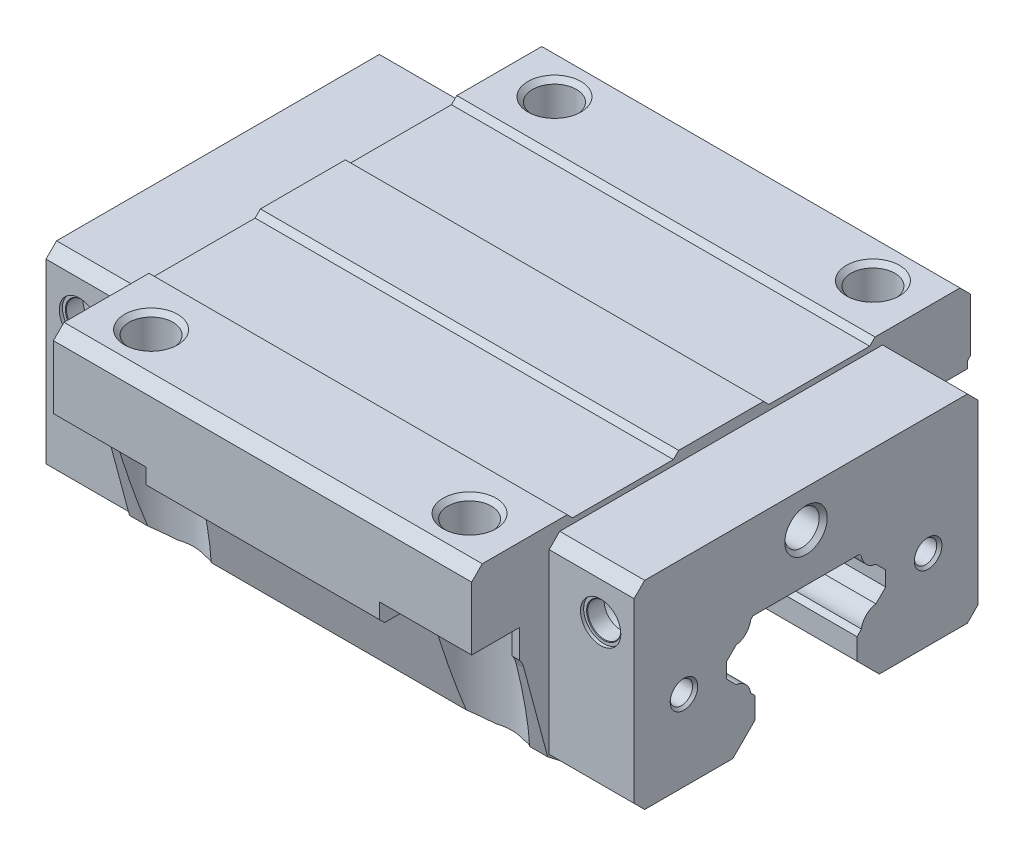
from build123d import *

# Parameters (mm, degrees)
EXTRUDE_1_DEPTH          = 19.7
EXTRUDE_1_DEPTH_BACK     = 19.7
EXTRUDE_2_DEPTH          = 27.7
EXTRUDE_2_DEPTH_BACK     = 27.7
CUT_EXTRUDE_1_DEPTH      = 19.7
CUT_EXTRUDE_1_DEPTH_BACK = 19.7
CUT_EXTRUDE_2_DEPTH      = 19.7
CUT_EXTRUDE_START        = -19.7
CUT_EXTRUDE_3_DEPTH      = 19.7
CUT_EXTRUDE_4_DEPTH      = 19.7
CUT_EXTRUDE_5_DEPTH      = 19.7


with BuildPart() as part:
    # Эскиз1 → Бобышка-Вытянуть1 (new, two sides: drawn at the far end of the back side and taken through both)
    with BuildSketch(Plane(origin=(0, 0, 0), x_dir=(0, 0, -1), z_dir=(1, 0, 0)).offset(-EXTRUDE_1_DEPTH_BACK)):
        with BuildLine():
            Line((-23.5, 18.702979439), (-23.5, 11.298510281))
            Line((-23.5, 11.298510281), (-23.001489719, 10.8))
            Line((-23.001489719, 10.8), (-20.534653976, 10.8))
            ThreePointArc((-20.534653976, 10.8), (-19.317131118, 10.386706681), (-18.602802323, 9.31763809))
            Line((-18.602802323, 9.31763809), (-16.33614388, 0.858353615))
            Line((-16.33614388, 0.858353615), (-15.21751567, 0))
            Line((-15.21751567, 0), (15.21751567, 0))
            Line((15.21751567, 0), (16.33614388, 0.858353615))
            Line((16.33614388, 0.858353615), (18.602802323, 9.31763809))
            ThreePointArc((18.602802323, 9.31763809), (19.317131118, 10.386706681), (20.534653976, 10.8))
            Line((20.534653976, 10.8), (22.701489719, 10.8))
            Line((22.701489719, 10.8), (23.2, 11.298510281))
            Line((23.2, 11.298510281), (23.2, 13.4))
            Line((23.2, 13.4), (23.5, 13.7))
            Line((23.5, 13.7), (23.5, 18.702979439))
            Line((23.5, 18.702979439), (22.502979439, 19.7))
            Line((22.502979439, 19.7), (14.5, 19.7))
            Line((14.5, 19.7), (14, 19.2))
            Line((14, 19.2), (4.5, 19.2))
            Line((4.5, 19.2), (4, 19.7))
            Line((4, 19.7), (-4, 19.7))
            Line((-4, 19.7), (-4.5, 19.2))
            Line((-4.5, 19.2), (-14, 19.2))
            Line((-14, 19.2), (-14.5, 19.7))
            Line((-14.5, 19.7), (-22.502979439, 19.7))
            Line((-22.502979439, 19.7), (-23.5, 18.702979439))
        make_face()
    extrude(amount=EXTRUDE_1_DEPTH + EXTRUDE_1_DEPTH_BACK)

    # Эскиз2 → Бобышка-Вытянуть2 (add, two sides: drawn at the far end of the back side and taken through both)
    with BuildSketch(Plane(origin=(0, 0, 0), x_dir=(0, 0, -1), z_dir=(1, 0, 0)).offset(-EXTRUDE_2_DEPTH_BACK)):
        Polygon((-16.2, 0.997020561), (-15.202979439, 0), (15.202979439, 0), (16.2, 0.997020561), (16.2, 17.702979439), (15.202979439, 18.7), (-15.202979439, 18.7), (-16.2, 17.702979439), align=None)
    extrude(amount=EXTRUDE_2_DEPTH + EXTRUDE_2_DEPTH_BACK)

    # Эскиз3 → Вырез-Вытянуть1 (cut, two sides: drawn at the far end of the back side and taken through both)
    with BuildSketch(Plane(origin=(0, 0, 0), x_dir=(0, 0, -1), z_dir=(1, 0, 0)).offset(-CUT_EXTRUDE_1_DEPTH_BACK)):
        with BuildLine():
            Line((-11.2, -4.3), (11.2, -4.3))
            Line((11.2, -4.3), (4.8, 2.1))
            Line((4.8, 2.1), (4.8, 4.1))
            Line((4.8, 4.1), (5.21443454, 4.51443454))
            ThreePointArc((5.21443454, 4.51443454), (5.66862915, 5.43137085), (6.58556546, 5.88556546))
            Line((6.58556546, 5.88556546), (7.5, 6.8))
            Line((7.5, 6.8), (7.5, 8.2))
            Line((7.5, 8.2), (6.58556546, 9.11443454))
            ThreePointArc((6.58556546, 9.11443454), (5.66862915, 9.56862915), (5.21443454, 10.48556546))
            Line((5.21443454, 10.48556546), (5, 10.7))
            Line((5, 10.7), (-5, 10.7))
            Line((-5, 10.7), (-5.21443454, 10.48556546))
            ThreePointArc((-5.21443454, 10.48556546), (-5.66862915, 9.56862915), (-6.58556546, 9.11443454))
            Line((-6.58556546, 9.11443454), (-7.5, 8.2))
            Line((-7.5, 8.2), (-7.5, 6.8))
            Line((-7.5, 6.8), (-6.58556546, 5.88556546))
            ThreePointArc((-6.58556546, 5.88556546), (-5.66862915, 5.43137085), (-5.21443454, 4.51443454))
            Line((-5.21443454, 4.51443454), (-4.8, 4.1))
            Line((-4.8, 4.1), (-4.8, 2.1))
            Line((-4.8, 2.1), (-11.2, -4.3))
        make_face()
    extrude(amount=CUT_EXTRUDE_1_DEPTH + CUT_EXTRUDE_1_DEPTH_BACK, mode=Mode.SUBTRACT)

    # Эскиз4 → Вырез-Вытянуть2 (cut)
    with BuildSketch(Plane(origin=(19.7, 0, 0), x_dir=(0, 0, -1), z_dir=(1, 0, 0))):
        with BuildLine():
            Line((-11.2, -4.3), (11.2, -4.3))
            Line((11.2, -4.3), (4.8, 2.1))
            Line((4.8, 2.1), (4.8, 4.1))
            Line((4.8, 4.1), (5.21443454, 4.51443454))
            ThreePointArc((5.21443454, 4.51443454), (5.66862915, 5.43137085), (6.58556546, 5.88556546))
            Line((6.58556546, 5.88556546), (7.5, 6.8))
            Line((7.5, 6.8), (7.5, 8.2))
            Line((7.5, 8.2), (6.58556546, 9.11443454))
            ThreePointArc((6.58556546, 9.11443454), (5.66862915, 9.56862915), (5.21443454, 10.48556546))
            Line((5.21443454, 10.48556546), (5, 10.7))
            Line((5, 10.7), (-5, 10.7))
            Line((-5, 10.7), (-5.21443454, 10.48556546))
            ThreePointArc((-5.21443454, 10.48556546), (-5.66862915, 9.56862915), (-6.58556546, 9.11443454))
            Line((-6.58556546, 9.11443454), (-7.5, 8.2))
            Line((-7.5, 8.2), (-7.5, 6.8))
            Line((-7.5, 6.8), (-6.58556546, 5.88556546))
            ThreePointArc((-6.58556546, 5.88556546), (-5.66862915, 5.43137085), (-5.21443454, 4.51443454))
            Line((-5.21443454, 4.51443454), (-4.8, 4.1))
            Line((-4.8, 4.1), (-4.8, 2.1))
            Line((-4.8, 2.1), (-11.2, -4.3))
        make_face()
    extrude(amount=CUT_EXTRUDE_2_DEPTH, mode=Mode.SUBTRACT)

    # Эскиз5 → Вырез-Вытянуть3 (cut)
    with BuildSketch(Plane(origin=(-19.7, 0, 0), x_dir=(0, 0, -1), z_dir=(1, 0, 0)).offset(CUT_EXTRUDE_START)):
        with BuildLine():
            Line((-11.2, -4.3), (11.2, -4.3))
            Line((11.2, -4.3), (4.8, 2.1))
            Line((4.8, 2.1), (4.8, 4.1))
            Line((4.8, 4.1), (5.21443454, 4.51443454))
            ThreePointArc((5.21443454, 4.51443454), (5.66862915, 5.43137085), (6.58556546, 5.88556546))
            Line((6.58556546, 5.88556546), (7.5, 6.8))
            Line((7.5, 6.8), (7.5, 8.2))
            Line((7.5, 8.2), (6.58556546, 9.11443454))
            ThreePointArc((6.58556546, 9.11443454), (5.66862915, 9.56862915), (5.21443454, 10.48556546))
            Line((5.21443454, 10.48556546), (5, 10.7))
            Line((5, 10.7), (-5, 10.7))
            Line((-5, 10.7), (-5.21443454, 10.48556546))
            ThreePointArc((-5.21443454, 10.48556546), (-5.66862915, 9.56862915), (-6.58556546, 9.11443454))
            Line((-6.58556546, 9.11443454), (-7.5, 8.2))
            Line((-7.5, 8.2), (-7.5, 6.8))
            Line((-7.5, 6.8), (-6.58556546, 5.88556546))
            ThreePointArc((-6.58556546, 5.88556546), (-5.66862915, 5.43137085), (-5.21443454, 4.51443454))
            Line((-5.21443454, 4.51443454), (-4.8, 4.1))
            Line((-4.8, 4.1), (-4.8, 2.1))
            Line((-4.8, 2.1), (-11.2, -4.3))
        make_face()
    extrude(amount=CUT_EXTRUDE_3_DEPTH, mode=Mode.SUBTRACT)

    # Эскиз6 → Вырез-Повернуть1 (revolve, cut)
    with BuildSketch(Plane.XY.offset(-19)):
        Polygon((15, 19.7), (17.5, 19.7), (17.067, 19.267), (17.067, 13.183), (17.5, 12.75), (17.5, 0), (15, 0), align=None)
    revolve(axis=Axis((15, 0, -19), (0, 1, 0)), mode=Mode.SUBTRACT)

    # Эскиз7 → Вырез-Повернуть2 (revolve, cut)
    with BuildSketch(Plane.XY.offset(-19)):
        Polygon((-15, 19.7), (-12.5, 19.7), (-12.933, 19.267), (-12.933, 13.183), (-12.5, 12.75), (-12.5, 0), (-15, 0), align=None)
    revolve(axis=Axis((-15, 0, -19), (0, 1, 0)), mode=Mode.SUBTRACT)

    # Эскиз8 → Вырез-Повернуть3 (revolve, cut)
    with BuildSketch(Plane.XY.offset(19)):
        Polygon((15, 19.7), (17.5, 19.7), (17.067, 19.267), (17.067, 13.183), (17.5, 12.75), (17.5, 0), (15, 0), align=None)
    revolve(axis=Axis((15, 0, 19), (0, 1, 0)), mode=Mode.SUBTRACT)

    # Эскиз9 → Вырез-Повернуть4 (revolve, cut)
    with BuildSketch(Plane.XY.offset(19)):
        Polygon((-15, 19.7), (-12.5, 19.7), (-12.933, 19.267), (-12.933, 13.183), (-12.5, 12.75), (-12.5, 0), (-15, 0), align=None)
    revolve(axis=Axis((-15, 0, 19), (0, 1, 0)), mode=Mode.SUBTRACT)

    # Эскиз10 → Вырез-Повернуть5 (revolve, cut)
    with BuildSketch(Plane.XY):
        Polygon((-27.7, 15.2), (-27.7, 17.2), (-27.321, 16.821), (-18.635884786, 16.821), (-17.7, 15.2), align=None)
    revolve(axis=Axis((-17.7, 15.2, 0), (-1, 0, 0)), mode=Mode.SUBTRACT)

    # Эскиз11 → Вырез-Повернуть6 (revolve, cut)
    with BuildSketch(Plane(origin=(24.55, 0, 0), x_dir=(0, 0, -1), z_dir=(1, 0, 0))):
        Polygon((-16.2, 14.2), (-16.2, 16.1), (-15.9, 16.1), (-15.9, 15.823033009), (-15.846966991, 15.77), (-14.3, 15.77), (-13.826572779, 14.95), (-13.826572779, 14.2), align=None)
    revolve(axis=Axis((24.55, 14.2, 13.826572779), (0, 0, 1)), mode=Mode.SUBTRACT)

    # Эскиз12 → Вырез-Повернуть7 (revolve, cut)
    with BuildSketch(Plane(origin=(-24.55, 0, 0), x_dir=(0, 0, -1), z_dir=(1, 0, 0))):
        Polygon((-16.2, 14.2), (-16.2, 16.1), (-15.9, 16.1), (-15.9, 15.823033009), (-15.846966991, 15.77), (-14.3, 15.77), (-13.826572779, 14.95), (-13.826572779, 14.2), align=None)
    revolve(axis=Axis((-24.55, 14.2, 13.826572779), (0, 0, 1)), mode=Mode.SUBTRACT)

    # Эскиз13 → Вырез-Повернуть8 (revolve, cut)
    with BuildSketch(Plane.XY.offset(11.5)):
        Polygon((-27.7, 7.555556), (-27.7, 8.855556), (-27.4565, 8.612056), (-17.7, 8.612056), (-17.090029441, 7.555556), align=None)
    revolve(axis=Axis((-17.090029441, 7.555556, 11.5), (-1, 0, 0)), mode=Mode.SUBTRACT)

    # Эскиз14 → Вырез-Повернуть9 (revolve, cut)
    with BuildSketch(Plane.XY.offset(11.5)):
        Polygon((17.090029441, 7.555556), (17.7, 8.612056), (27.4565, 8.612056), (27.7, 8.855556), (27.7, 7.555556), align=None)
    revolve(axis=Axis((27.7, 7.555556, 11.5), (-1, 0, 0)), mode=Mode.SUBTRACT)

    # Эскиз15 → Вырез-Повернуть10 (revolve, cut)
    with BuildSketch(Plane.XY.offset(-11.5)):
        Polygon((-27.7, 7.555556), (-27.7, 8.855556), (-27.4565, 8.612056), (-17.7, 8.612056), (-17.090029441, 7.555556), align=None)
    revolve(axis=Axis((-17.090029441, 7.555556, -11.5), (-1, 0, 0)), mode=Mode.SUBTRACT)

    # Эскиз16 → Вырез-Повернуть11 (revolve, cut)
    with BuildSketch(Plane.XY.offset(-11.5)):
        Polygon((17.090029441, 7.555556), (17.7, 8.612056), (27.4565, 8.612056), (27.7, 8.855556), (27.7, 7.555556), align=None)
    revolve(axis=Axis((27.7, 7.555556, -11.5), (-1, 0, 0)), mode=Mode.SUBTRACT)

    # Эскиз17 → Вырез-Повернуть12 (revolve, cut)
    with BuildSketch(Plane(origin=(-24.55, 0, 0), x_dir=(0, 0, -1), z_dir=(1, 0, 0))):
        Polygon((13.826572779, 14.2), (13.826572779, 14.95), (14.3, 15.77), (15.846966991, 15.77), (15.9, 15.823033009), (15.9, 16.1), (16.2, 16.1), (16.2, 14.2), align=None)
    revolve(axis=Axis((-24.55, 14.2, -16.2), (0, 0, 1)), mode=Mode.SUBTRACT)

    # Эскиз18 → Вырез-Повернуть13 (revolve, cut)
    with BuildSketch(Plane(origin=(24.55, 0, 0), x_dir=(0, 0, -1), z_dir=(1, 0, 0))):
        Polygon((13.826572779, 14.2), (13.826572779, 14.95), (14.3, 15.77), (15.846966991, 15.77), (15.9, 15.823033009), (15.9, 16.1), (16.2, 16.1), (16.2, 14.2), align=None)
    revolve(axis=Axis((24.55, 14.2, -16.2), (0, 0, 1)), mode=Mode.SUBTRACT)

    # Эскиз19 → Вырез-Повернуть14 (revolve, cut)
    with BuildSketch(Plane.XY):
        Polygon((17.7, 15.2), (18.635884786, 16.821), (27.321, 16.821), (27.7, 17.2), (27.7, 15.2), align=None)
    revolve(axis=Axis((27.7, 15.2, 0), (-1, 0, 0)), mode=Mode.SUBTRACT)

    # Эскиз20 → Вырез-Вытянуть4 (cut)
    with BuildSketch(Plane(origin=(0, 12.75, 0), x_dir=(1, 0, 0), z_dir=(0, 1, 0))):
        with BuildLine():
            Line((-27, -38), (27, -38))
            Line((27, -38), (27, -19))
            Line((27, -19), (19, -19))
            ThreePointArc((19, -19), (15, -15), (11, -19))
            Line((11, -19), (11, -30.4))
            Line((11, -30.4), (-11, -30.4))
            Line((-11, -30.4), (-11, -19))
            ThreePointArc((-11, -19), (-15, -15), (-19, -19))
            Line((-19, -19), (-27, -19))
            Line((-27, -19), (-27, -38))
        make_face()
    extrude(amount=-CUT_EXTRUDE_4_DEPTH, mode=Mode.SUBTRACT)

    # Эскиз21 → Вырез-Вытянуть5 (cut)
    with BuildSketch(Plane(origin=(0, 12.75, 0), x_dir=(1, 0, 0), z_dir=(0, 1, 0))):
        with BuildLine():
            Line((-27, 38), (-27, 19))
            Line((-27, 19), (-19, 19))
            ThreePointArc((-19, 19), (-15, 15), (-11, 19))
            Line((-11, 19), (-11, 30.4))
            Line((-11, 30.4), (11, 30.4))
            Line((11, 30.4), (11, 19))
            ThreePointArc((11, 19), (15, 15), (19, 19))
            Line((19, 19), (27, 19))
            Line((27, 19), (27, 38))
            Line((27, 38), (-27, 38))
        make_face()
    extrude(amount=-CUT_EXTRUDE_5_DEPTH, mode=Mode.SUBTRACT)


solid = part.part
